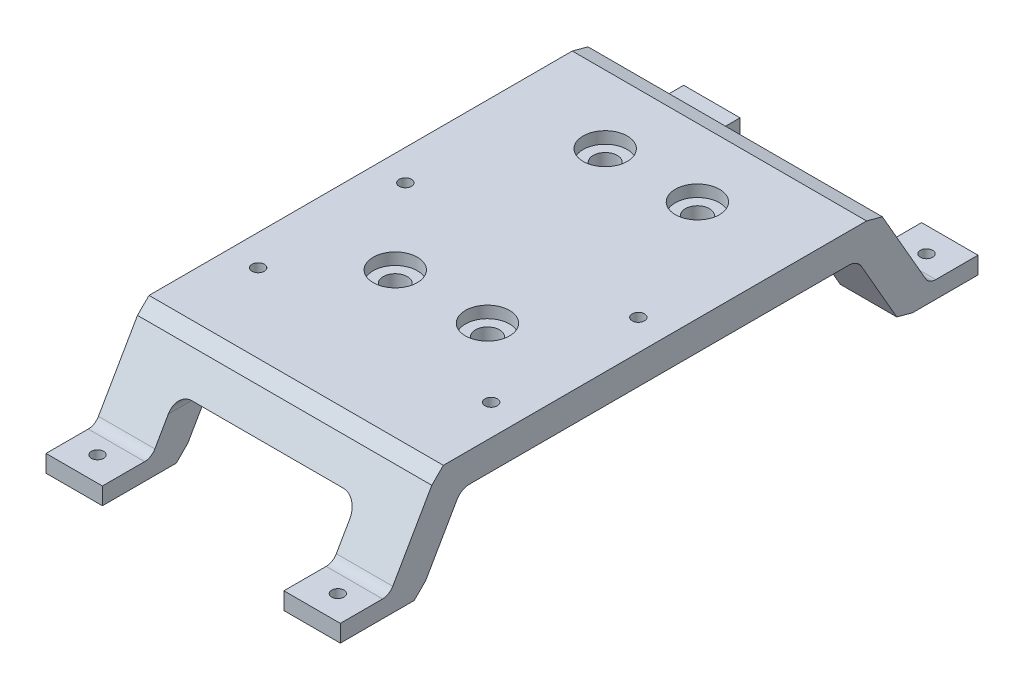
from build123d import *
from OCP.BRepFilletAPI import BRepFilletAPI_MakeChamfer

# Parameters (mm, degrees)
BOSS_EXTRUDE1_DEPTH           = 38.1
SKETCH2_R                     = 3.1115
CASTER_MOUNT_HOLES_DEPTH      = 159.225945815
SKETCH6_R                     = 1.5875
FRAME_MOUNTHOLES_DEPTH        = 159.636980569
SKETCH7_W                     = 46.99
SKETCH7_H                     = 15.875
LEG_CUTOUTS_DEPTH             = 172.505541744
CHAMFER1_SIZE                 = 1.27
CHAMFER1_SIZE2                = 3.444253967
SKETCH8_R                     = 1.5875
ELECTRONICS_MOUNT_HOLES_DEPTH = 159.225945815
CHAMFER2_SIZE                 = 1.27
CHAMFER2_SIZE2                = 3.444253967
FILLET1_R                     = 3.81
FILLET2_R                     = 3.048
SKETCH9_R                     = 5.715
CUT_EXTRUDE1_DEPTH            = 3.048
SKETCH10_R                    = 3.175
CUT_EXTRUDE2_DEPTH            = 2.159


with BuildPart() as part:
    # Sketch1 → Boss-Extrude1 (new, symmetric)
    with BuildSketch(Plane(origin=(0, 0, 0), x_dir=(0, 0, -1), z_dir=(1, 0, 0))):
        Polygon((-152.4, 0), (-132.001014052, 0), (-121.125726695, 18.923), (-18.574273305, 18.923), (-7.698985948, 0), (12.7, 0), (12.7, 4.445), (0, 4.445), (-12.7, 26.543), (-127, 26.543), (-139.7, 4.445), (-152.4, 4.445), align=None)
    extrude(amount=BOSS_EXTRUDE1_DEPTH, both=True)

    # Sketch2 → Caster-Mount-Holes (cut, through all)
    with BuildSketch(Plane.XZ.offset(-18.923)):
        with Locations(Location((-11.938, 88.138, 0), (0, 0, 270))):
            Circle(SKETCH2_R)
        with Locations(Location((11.938, 88.138, 0), (0, 0, 270))):
            Circle(SKETCH2_R)
        with Locations(Location((11.938, 33.782, 0), (0, 0, 90))):
            Circle(SKETCH2_R)
        with Locations(Location((-11.938, 33.782, 0), (0, 0, 90))):
            Circle(SKETCH2_R)
    extrude(amount=-CASTER_MOUNT_HOLES_DEPTH, mode=Mode.SUBTRACT)

    # Sketch6 → Frame-MountHoles (cut, through all)
    with BuildSketch(Plane(origin=(0, 4.445, 0), x_dir=(1, 0, 0), z_dir=(0, 1, 0))):
        with Locations(Location((-31.115, 6.35, 0), (0, 0, 270))):
            Circle(SKETCH6_R)
        with Locations(Location((31.115, 6.35, 0), (0, 0, 90))):
            Circle(SKETCH6_R)
        with Locations(Location((31.115, -146.05, 0), (0, 0, 270))):
            Circle(SKETCH6_R)
        with Locations(Location((-31.115, -146.05, 0), (0, 0, 90))):
            Circle(SKETCH6_R)
    extrude(amount=-FRAME_MOUNTHOLES_DEPTH, mode=Mode.SUBTRACT)

    # Sketch7 → Leg-Cutouts (cut, through all)
    with BuildSketch(Plane(origin=(0, 0, -12.7), x_dir=(-1, 0, 0), z_dir=(0, 0, -1))):
        with Locations((0, 7.9375)):
            Rectangle(SKETCH7_W, SKETCH7_H)
    extrude(amount=-LEG_CUTOUTS_DEPTH, mode=Mode.SUBTRACT)

    # Chamfer1: one chamfer whose edges measure the first distance from different faces: ONE call of the kernel's chamfer builder (chamfer() names one face for all edges)
    chamfer1_edges_1 = [part.edges().sort_by_distance(p)[0] for p in [
        (30.7975, 0, 7.698985948),
        (-30.7975, 0, 7.698985948),
    ]]
    chamfer1_side_1 = [part.faces().sort_by_distance(p)[0] for p in [
        (0, 18.235769515, 18.179313256),
    ]]
    chamfer1_edges_2 = [part.edges().sort_by_distance(p)[0] for p in [
        (30.7975, 0, 132.001014052),
    ]]
    chamfer1_side_2 = [part.faces().sort_by_distance(p)[0] for p in [
        (30.788832212, 0, 142.09541541),
    ]]
    chamfer1_edges_3 = [part.edges().sort_by_distance(p)[0] for p in [
        (-30.7975, 0, 132.001014052),
    ]]
    chamfer1_side_3 = [part.faces().sort_by_distance(p)[0] for p in [
        (-30.788832212, 0, 142.09541541),
    ]]
    chamfer1 = BRepFilletAPI_MakeChamfer(part.part.solid().wrapped)
    for e in chamfer1_edges_1:
        chamfer1.Add(CHAMFER1_SIZE, CHAMFER1_SIZE2, e.wrapped, chamfer1_side_1[0].wrapped)  # the first distance lies on this face
    for e in chamfer1_edges_2:
        chamfer1.Add(CHAMFER1_SIZE, CHAMFER1_SIZE2, e.wrapped, chamfer1_side_2[0].wrapped)  # the first distance lies on this face
    for e in chamfer1_edges_3:
        chamfer1.Add(CHAMFER1_SIZE, CHAMFER1_SIZE2, e.wrapped, chamfer1_side_3[0].wrapped)  # the first distance lies on this face
    add(Compound.cast(chamfer1.Shape()), mode=Mode.REPLACE)

    # Sketch8 → Electronics-Mount-Holes (cut, through all)
    with BuildSketch(Plane.XZ.offset(-18.923)):
        with Locations(Location((-30.1625, 105.41, 0), (0, 0, 270))):
            Circle(SKETCH8_R)
        with Locations(Location((-30.1625, 67.31, 0), (0, 0, 270))):
            Circle(SKETCH8_R)
        with Locations(Location((30.1625, 67.31, 0), (0, 0, 90))):
            Circle(SKETCH8_R)
        with Locations(Location((30.1625, 105.41, 0), (0, 0, 90))):
            Circle(SKETCH8_R)
    extrude(amount=-ELECTRONICS_MOUNT_HOLES_DEPTH, mode=Mode.SUBTRACT)

    # Chamfer2: one chamfer whose edges measure the first distance from different faces: ONE call of the kernel's chamfer builder (chamfer() names one face for all edges)
    chamfer2_edges_1 = [part.edges().sort_by_distance(p)[0] for p in [
        (0, 26.543, 127),
    ]]
    chamfer2_side_1 = [part.faces().sort_by_distance(p)[0] for p in [
        (0, 26.543, 69.915297007),
    ]]
    chamfer2_edges_2 = [part.edges().sort_by_distance(p)[0] for p in [
        (0, 26.543, 12.7),
    ]]
    chamfer2_side_2 = [part.faces().sort_by_distance(p)[0] for p in [
        (0, 17.992202532, 7.785748581),
    ]]
    chamfer2 = BRepFilletAPI_MakeChamfer(part.part.solid().wrapped)
    for e in chamfer2_edges_1:
        chamfer2.Add(CHAMFER2_SIZE, CHAMFER2_SIZE2, e.wrapped, chamfer2_side_1[0].wrapped)  # the first distance lies on this face
    for e in chamfer2_edges_2:
        chamfer2.Add(CHAMFER2_SIZE, CHAMFER2_SIZE2, e.wrapped, chamfer2_side_2[0].wrapped)  # the first distance lies on this face
    add(Compound.cast(chamfer2.Shape()), mode=Mode.REPLACE)

    # Fillet1
    fillet1_edges = [part.edges().sort_by_distance(p)[0] for p in [
        (0, 18.923, 18.574273305),
        (0, 18.923, 121.125726695),
        (23.495, 15.875, 11.695757342),
        (23.495, 15.875, 128.004242658),
        (-23.495, 15.875, 128.004242658),
        (-23.495, 15.875, 11.695757342),
    ]]
    fillet(fillet1_edges, radius=FILLET1_R)

    # Fillet2
    fillet2_edges = [part.edges().sort_by_distance(p)[0] for p in [
        (30.7975, 4.445, 0),
        (30.7975, 4.445, 139.7),
        (-30.7975, 4.445, 0),
        (-30.7975, 4.445, 139.7),
    ]]
    fillet(fillet2_edges, radius=FILLET2_R)

    # Sketch9 → Cut-Extrude1 (cut)
    with BuildSketch(Plane(origin=(0, 26.543, 0), x_dir=(1, 0, 0), z_dir=(0, 1, 0))):
        with Locations(Location((-11.938, -33.782, 0), (0, 0, 270))):
            Circle(SKETCH9_R)
        with Locations(Location((11.938, -33.782, 0), (0, 0, 270))):
            Circle(SKETCH9_R)
        with Locations(Location((-11.938, -88.138, 0), (0, 0, 270))):
            Circle(SKETCH9_R)
        with Locations(Location((11.938, -88.138, 0), (0, 0, 270))):
            Circle(SKETCH9_R)
    extrude(amount=-CUT_EXTRUDE1_DEPTH, mode=Mode.SUBTRACT)

    # Sketch10 → Cut-Extrude2 (cut)
    with BuildSketch(Plane.XZ.offset(-18.923)):
        with Locations(Location((-30.1625, 105.41, 0), (0, 0, 270))):
            Circle(SKETCH10_R)
        with Locations(Location((-30.1625, 67.31, 0), (0, 0, 270))):
            Circle(SKETCH10_R)
        with Locations(Location((30.1625, 105.41, 0), (0, 0, 270))):
            Circle(SKETCH10_R)
        with Locations(Location((30.1625, 67.31, 0), (0, 0, 270))):
            Circle(SKETCH10_R)
    extrude(amount=-CUT_EXTRUDE2_DEPTH, mode=Mode.SUBTRACT)


solid = part.part
